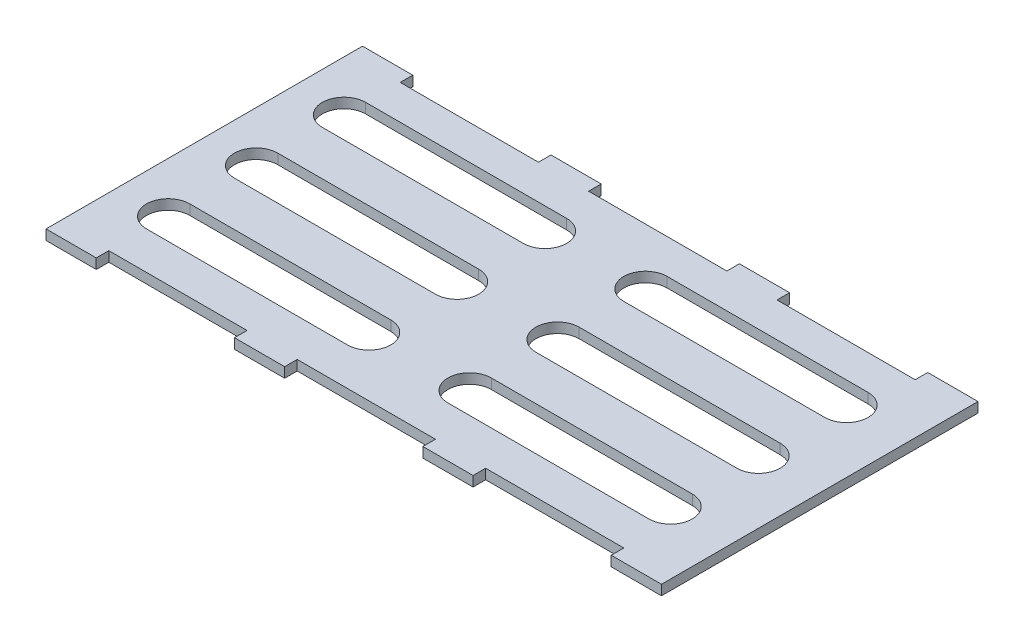
from build123d import *

# Parameters (mm, degrees)
BOSS_EXTRUDE1_DEPTH = 4


with BuildPart() as part:
    # Sketch1 → Boss-Extrude1 (new body)
    with BuildSketch(Plane(origin=(0, 0, 0), x_dir=(1, 0, 0), z_dir=(0, 1, 0))):
        Polygon((-69.534910804, 105.258653628), (-49.534910804, 105.258653628), (-49.534910804, 100.258653628), (5.503649635, 100.258653628), (5.465089196, 105.258653628), (25.465089196, 105.258653628), (25.465089196, 100.258653628), (80.465089196, 100.258653628), (80.465089196, 105.258653628), (100.465089196, 105.258653628), (100.465089196, 100.258653628), (100.465089196, -15.741346372), (100.465089196, -20.741346372), (80.465089196, -20.741346372), (80.465089196, -15.741346372), (25.465089196, -15.741346372), (25.465089196, -20.741346372), (5.465089196, -20.741346372), (5.503649635, -15.741346372), (-49.534910804, -15.741346372), (-49.534910804, -20.741346372), (-69.534910804, -20.741346372), (-69.496350365, -15.741346372), (-124.534910804, -15.741346372), (-124.534910804, -20.741346372), (-144.534910804, -20.741346372), (-144.534910804, 105.258653628), (-124.534910804, 105.258653628), (-124.534910804, 100.258653628), (-69.496350365, 100.258653628), align=None)
        with BuildLine():
            Line((-4.534910804, 86.514295241), (75.465089196, 86.514295241))
            ThreePointArc((75.465089196, 86.514295241), (84.091672485, 77.887711952), (75.465089196, 69.261128664))
            Line((75.465089196, 69.261128664), (-4.534910804, 69.261128664))
            ThreePointArc((-4.534910804, 69.261128664), (-13.161494092, 77.887711952), (-4.534910804, 86.514295241))
        make_face(mode=Mode.SUBTRACT)
        with BuildLine():
            Line((-124.534910804, 86.514295241), (-44.534910804, 86.514295241))
            ThreePointArc((-44.534910804, 86.514295241), (-35.908327515, 77.887711952), (-44.534910804, 69.261128664))
            Line((-44.534910804, 69.261128664), (-124.534910804, 69.261128664))
            ThreePointArc((-124.534910804, 69.261128664), (-133.161494092, 77.887711952), (-124.534910804, 86.514295241))
        make_face(mode=Mode.SUBTRACT)
        with BuildLine():
            Line((-4.534910804, 51.514295241), (75.465089196, 51.514295241))
            ThreePointArc((75.465089196, 51.514295241), (84.091672485, 42.887711952), (75.465089196, 34.261128664))
            Line((75.465089196, 34.261128664), (-4.534910804, 34.261128664))
            ThreePointArc((-4.534910804, 34.261128664), (-13.161494092, 42.887711952), (-4.534910804, 51.514295241))
        make_face(mode=Mode.SUBTRACT)
        with BuildLine():
            Line((-4.534910804, 16.514295241), (75.465089196, 16.514295241))
            ThreePointArc((75.465089196, 16.514295241), (84.091672485, 7.887711952), (75.465089196, -0.738871336))
            Line((75.465089196, -0.738871336), (-4.534910804, -0.738871336))
            ThreePointArc((-4.534910804, -0.738871336), (-13.161494092, 7.887711952), (-4.534910804, 16.514295241))
        make_face(mode=Mode.SUBTRACT)
        with BuildLine():
            Line((-124.534910804, 51.514295241), (-44.534910804, 51.514295241))
            ThreePointArc((-44.534910804, 51.514295241), (-35.908327515, 42.887711952), (-44.534910804, 34.261128664))
            Line((-44.534910804, 34.261128664), (-124.534910804, 34.261128664))
            ThreePointArc((-124.534910804, 34.261128664), (-133.161494092, 42.887711952), (-124.534910804, 51.514295241))
        make_face(mode=Mode.SUBTRACT)
        with BuildLine():
            Line((-124.534910804, 16.514295241), (-44.534910804, 16.514295241))
            ThreePointArc((-44.534910804, 16.514295241), (-35.908327515, 7.887711952), (-44.534910804, -0.738871336))
            Line((-44.534910804, -0.738871336), (-124.534910804, -0.738871336))
            ThreePointArc((-124.534910804, -0.738871336), (-133.161494092, 7.887711952), (-124.534910804, 16.514295241))
        make_face(mode=Mode.SUBTRACT)
    extrude(amount=BOSS_EXTRUDE1_DEPTH)


solid = part.part
